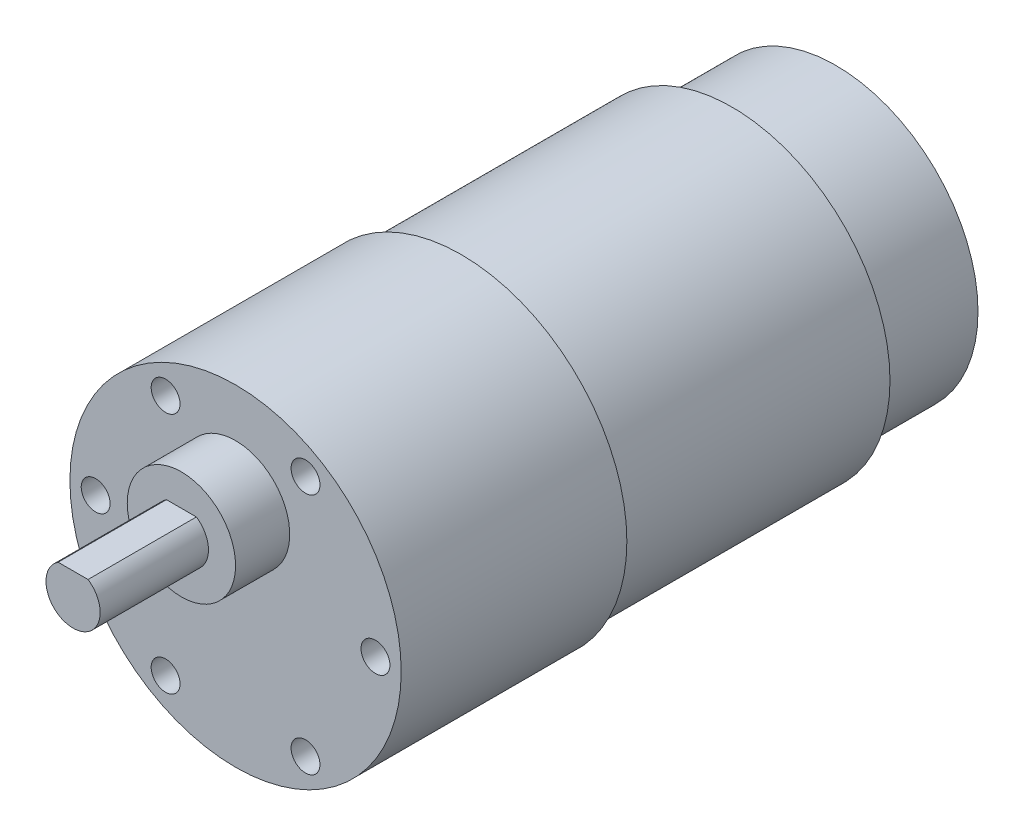
from build123d import *

# Parameters (mm, degrees)
SKETCH1_W               = 11.5
SKETCH1_H               = 15.75
SKETCH2_R               = 6
BOSS_EXTRUDE1_DEPTH     = 6
SKETCH3_R               = 3
BOSS_EXTRUDE2_DEPTH     = 12
SKETCH4_R               = 1.6
CUT_EXTRUDE1_DEPTH      = 6
CUT_EXTRUDE2_DEPTH      = 94.60659699
CUT_EXTRUDE2_DEPTH_BACK = 12


with BuildPart() as part:
    # Sketch1 → Revolve1 (revolve)
    with BuildSketch(Plane(origin=(0, 0, 0), x_dir=(0, 0, -1), z_dir=(1, 0, 0)), mode=Mode.PRIVATE) as revolve1_sk:
        with Locations((35.75, -25.375)):
            Rectangle(SKETCH1_W, SKETCH1_H)
        Polygon((30, -17.5), (0, -17.5), (0, -35), (30, -35), (30, -33.25), align=None)
        Polygon((0, -17.5), (-25, -17.5), (-25, -35.85), (0, -35.85), (0, -35), align=None)
    revolve(revolve1_sk.sketch.rotate(Axis((0, -17.5, 25), (0, 0, -1)), 270), axis=Axis((0, -17.5, 25), (0, 0, -1)))

    # Sketch2 → Boss-Extrude1 (add)
    with BuildSketch(Plane.XY.offset(25)):
        with Locations(Location((0, -10.5, 0), (0, 0, 180))):
            Circle(SKETCH2_R)
    extrude(amount=BOSS_EXTRUDE1_DEPTH)

    # Sketch3 → Boss-Extrude2 (add)
    with BuildSketch(Plane.XY.offset(31)):
        with Locations((0, -10.5)):
            Circle(SKETCH3_R)
    extrude(amount=BOSS_EXTRUDE2_DEPTH)

    # Sketch4 → Cut-Extrude1 (cut)
    with BuildSketch(Plane.XY.offset(25)):
        with Locations((-15.5, -17.5)):
            Circle(SKETCH4_R)
        with Locations((15.5, -17.5)):
            Circle(SKETCH4_R)
        with Locations((-7.75, -4.076606241)):
            Circle(SKETCH4_R)
        with Locations((7.75, -4.076606241)):
            Circle(SKETCH4_R)
        with Locations((7.75, -30.923393759)):
            Circle(SKETCH4_R)
        with Locations((-7.75, -30.923393759)):
            Circle(SKETCH4_R)
    extrude(amount=-CUT_EXTRUDE1_DEPTH, mode=Mode.SUBTRACT)

    # Sketch5 → Cut-Extrude2 (cut, two sides: drawn at the far end of the back side and taken through both)
    with BuildSketch(Plane.XY.offset(43).offset(-CUT_EXTRUDE2_DEPTH_BACK)):
        with BuildLine():
            Line((-1.658312395, -8), (1.658312395, -8))
            ThreePointArc((1.658312395, -8), (0, -7.5), (-1.658312395, -8))
        make_face()
    extrude(amount=CUT_EXTRUDE2_DEPTH + CUT_EXTRUDE2_DEPTH_BACK, mode=Mode.SUBTRACT)


solid = part.part
